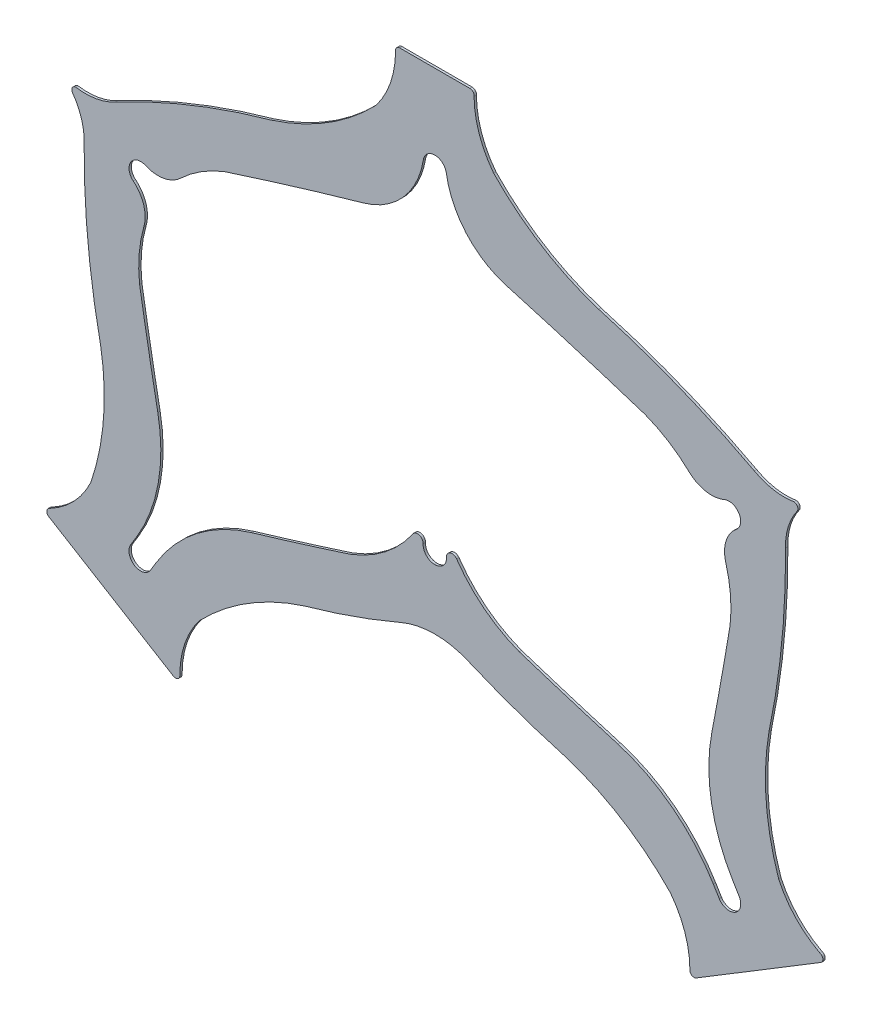
from build123d import *

# Parameters (mm, degrees)
BOSS_EXTRUDE1_DEPTH = 6.35


with BuildPart() as part:
    # Model → Boss-Extrude1 (new body)
    with BuildSketch(Plane.XY):
        with BuildLine():
            Line((-1054.530174704, -445.805078084), (-884.322818744, -549.29009194))
            Line((-884.322818744, -549.29009194), (-714.115462784, -652.775105795))
            ThreePointArc((-714.115462784, -652.775105795), (-701.480767956, -652.403779037), (-696.673957546, -640.713271323))
            ThreePointArc((-696.673957546, -640.713271323), (-682.646209507, -559.054736821), (-643.171312347, -486.208141388))
            ThreePointArc((-643.171312347, -486.208141388), (-621.164389939, -464.314654904), (-598.187283298, -443.44165908))
            ThreePointArc((-598.187283298, -443.44165908), (-484.269299036, -363.338503482), (-356.49421429, -307.954838084))
            ThreePointArc((-356.49421429, -307.954838084), (-222.422842463, -265.70956843), (-91.419363532, -214.740126023))
            ThreePointArc((-91.419363532, -214.740126023), (-46.529578977, -200.730515706), (0.262323317, -196.052928909))
            ThreePointArc((0.262323317, -196.052928909), (47.054225612, -200.730515706), (91.944010166, -214.740126023))
            ThreePointArc((91.944010166, -214.740126023), (222.947489099, -265.709568431), (357.018860928, -307.954838085))
            ThreePointArc((357.018860928, -307.954838085), (484.793945672, -363.338503483), (598.711929932, -443.44165908))
            ThreePointArc((598.711929932, -443.44165908), (621.689036573, -464.314654904), (643.695958982, -486.208141388))
            ThreePointArc((643.695958982, -486.208141388), (683.170856142, -559.054736821), (697.19860418, -640.713271323))
            ThreePointArc((697.19860418, -640.713271323), (702.005414591, -652.403779037), (714.640109418, -652.775105795))
            Line((714.640109418, -652.775105795), (884.847465378, -549.29009194))
            Line((884.847465378, -549.29009194), (1055.054821338, -445.805078084))
            ThreePointArc((1055.054821338, -445.805078084), (1060.539897468, -434.417043276), (1052.373199847, -424.76932609))
            ThreePointArc((1052.373199847, -424.76932609), (986.332213878, -374.734516765), (939.825801838, -306.163038647))
            ThreePointArc((939.825801838, -306.163038647), (905.589204406, -139.536796819), (913.506255339, 30.386036768))
            ThreePointArc((913.506255339, 30.386036768), (948.294313295, 257.241539714), (958.549670474, 486.519658693))
            ThreePointArc((958.549670474, 486.519658693), (966.113332281, 541.638264925), (991.360607576, 591.214920954))
            ThreePointArc((991.360607576, 591.214920954), (992.365203384, 596.69892445), (990.697417794, 602.018886698))
            ThreePointArc((990.697417794, 602.018886698), (986.741878389, 605.947908853), (981.410818468, 607.57987307))
            ThreePointArc((981.410818468, 607.57987307), (925.777119065, 607.981399504), (873.361605838, 626.633040341))
            ThreePointArc((873.361605838, 626.633040341), (665.08766839, 723.046707283), (447.674096575, 796.565187843))
            ThreePointArc((447.674096575, 796.565187843), (319.899011826, 851.948853241), (205.981027563, 932.05200884))
            ThreePointArc((205.981027563, 932.05200884), (183.003920922, 952.925004664), (160.996998513, 974.818491148))
            ThreePointArc((160.996998513, 974.818491148), (121.522101353, 1047.665086581), (107.494353315, 1129.323621083))
            ThreePointArc((107.494353315, 1129.323621083), (105.018531072, 1138.878845883), (96.08411041, 1143.075051813))
            Line((96.08411041, 1143.075051813), (0.262323317, 1143.075051813))
            Line((0.262323317, 1143.075051813), (-95.559463776, 1143.075051813))
            ThreePointArc((-95.559463776, 1143.075051813), (-104.493884438, 1138.878845883), (-106.969706681, 1129.323621083))
            ThreePointArc((-106.969706681, 1129.323621083), (-120.997454719, 1047.665086581), (-160.472351879, 974.818491148))
            ThreePointArc((-160.472351879, 974.818491148), (-182.479274288, 952.925004664), (-205.456380929, 932.05200884))
            ThreePointArc((-205.456380929, 932.05200884), (-319.374365192, 851.948853241), (-447.149449941, 796.565187843))
            ThreePointArc((-447.149449941, 796.565187843), (-664.563021755, 723.046707284), (-872.836959201, 626.633040343))
            ThreePointArc((-872.836959201, 626.633040343), (-925.252472429, 607.981399504), (-980.886171834, 607.57987307))
            ThreePointArc((-980.886171834, 607.57987307), (-986.217231755, 605.947908853), (-990.17277116, 602.018886698))
            ThreePointArc((-990.17277116, 602.018886698), (-991.84055675, 596.69892445), (-990.835960942, 591.214920954))
            ThreePointArc((-990.835960942, 591.214920954), (-965.588685647, 541.638264925), (-958.02502384, 486.519658693))
            ThreePointArc((-958.02502384, 486.519658693), (-947.769666661, 257.241539714), (-912.981608705, 30.386036767))
            ThreePointArc((-912.981608705, 30.386036767), (-905.064557772, -139.536796819), (-939.301155204, -306.163038647))
            ThreePointArc((-939.301155204, -306.163038647), (-985.807567244, -374.734516765), (-1051.848553213, -424.76932609))
            ThreePointArc((-1051.848553213, -424.76932609), (-1060.015250834, -434.417043276), (-1054.530174704, -445.805078084))
        make_face()
        with BuildLine():
            ThreePointArc((-776.776730114, -433.518633987), (-820.400407489, -444.153471661), (-831.035245163, -400.529794286))
            Line((-831.035245163, -400.529794286), (-814.995386538, -374.148178004))
            ThreePointArc((-814.995386538, -374.148178004), (-755.681673534, -217.587288079), (-756.705863237, -50.170503258))
            ThreePointArc((-756.705863237, -50.170503258), (-782.502405832, 88.627483964), (-806.4955468, 227.748553731))
            ThreePointArc((-806.4955468, 227.748553731), (-807.727163724, 299.824157666), (-794.734772679, 370.729780417))
            ThreePointArc((-794.734772679, 370.729780417), (-795.278719619, 421.74664414), (-823.780399516, 464.062959025))
            ThreePointArc((-823.780399516, 464.062959025), (-830.772921751, 505.10476961), (-791.117705256, 517.785045164))
            ThreePointArc((-791.117705256, 517.785045164), (-740.432028836, 511.955939897), (-694.888676898, 534.952012531))
            ThreePointArc((-694.888676898, 534.952012531), (-637.917685406, 579.118919726), (-573.361803176, 611.196133327))
            ThreePointArc((-573.361803176, 611.196133327), (-384.318244806, 670.678328168), (-194.222460106, 726.706812923))
            ThreePointArc((-194.222460106, 726.706812923), (-85.829836181, 794.87078756), (-31.092943269, 910.625532232))
            ThreePointArc((-31.092943269, 910.625532232), (-20.348344787, 929.785400257), (0.262323317, 937.384564654))
            ThreePointArc((0.262323317, 937.384564654), (20.872991421, 929.785400257), (31.617589903, 910.625532232))
            ThreePointArc((31.617589903, 910.625532232), (86.354482821, 794.870787553), (194.747106759, 726.706812918))
            ThreePointArc((194.747106759, 726.706812918), (384.842891449, 670.678328165), (573.886449811, 611.196133327))
            ThreePointArc((573.886449811, 611.196133327), (638.44233204, 579.118919726), (695.413323532, 534.952012531))
            ThreePointArc((695.413323532, 534.952012531), (740.95667547, 511.955939897), (791.642351891, 517.785045164))
            ThreePointArc((791.642351891, 517.785045164), (831.297568385, 505.10476961), (824.30504615, 464.062959025))
            ThreePointArc((824.30504615, 464.062959025), (795.803366253, 421.74664414), (795.259419313, 370.729780417))
            ThreePointArc((795.259419313, 370.729780417), (808.251810359, 299.824157666), (807.020193434, 227.748553731))
            ThreePointArc((807.020193434, 227.748553731), (783.027052467, 88.627483964), (757.230509871, -50.170503258))
            ThreePointArc((757.230509871, -50.170503258), (756.206320168, -217.587288079), (815.520033172, -374.148178004))
            Line((815.520033172, -374.148178004), (831.559891797, -400.529794286))
            ThreePointArc((831.559891797, -400.529794286), (820.925054123, -444.153471661), (777.301376749, -433.518633987))
            Line((777.301376749, -433.518633987), (761.261518123, -407.137017703))
            ThreePointArc((761.261518123, -407.137017703), (649.563377324, -282.425534082), (500.458599124, -206.28622805))
            ThreePointArc((500.458599124, -206.28622805), (365.360989591, -165.310884678), (230.806507684, -122.585783567))
            ThreePointArc((230.806507684, -122.585783567), (135.195604422, -68.689901345), (59.989781623, 11.249420395))
            ThreePointArc((59.989781623, 11.249420395), (42.5119564, 17.019369979), (32.226042951, 1.756124019))
            ThreePointArc((32.226042951, 1.756124019), (23.509796029, -21.903091273), (0.298037309, -31.7491913))
            ThreePointArc((0.298037309, -31.7491913), (0.280180346, -31.749313732), (0.262323317, -31.749426121))
            ThreePointArc((0.262323317, -31.749426121), (0.244466288, -31.749313732), (0.226609326, -31.7491913))
            ThreePointArc((0.226609326, -31.7491913), (-22.985149395, -21.903091273), (-31.701396317, 1.756124019))
            ThreePointArc((-31.701396317, 1.756124019), (-41.987309766, 17.019369979), (-59.465134989, 11.249420395))
            ThreePointArc((-59.465134989, 11.249420395), (-134.670957788, -68.689901345), (-230.28186105, -122.585783567))
            ThreePointArc((-230.28186105, -122.585783567), (-364.836342957, -165.310884677), (-499.93395249, -206.28622805))
            ThreePointArc((-499.93395249, -206.28622805), (-649.038730689, -282.425534082), (-760.736871489, -407.137017703))
            Line((-760.736871489, -407.137017703), (-776.776730114, -433.518633987))
        make_face(mode=Mode.SUBTRACT)
    extrude(amount=BOSS_EXTRUDE1_DEPTH)


solid = part.part
